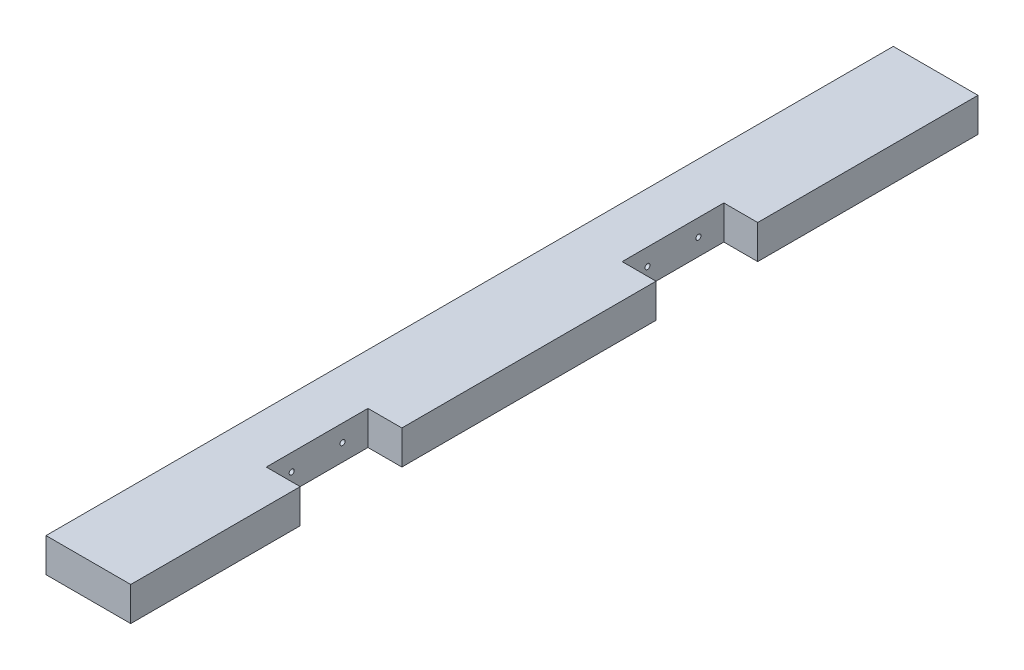
from build123d import *

# Parameters (mm, degrees)
SKIZZE1_W                       = 50
SKIZZE1_H                       = 20
AUFSATZ_LINEAR_AUSTRAGEN1_DEPTH = 500
SKIZZE2_W                       = 20
SKIZZE2_H                       = 60
SCHNITT_LINEAR_AUSTRAGEN1_DEPTH = 502.023951523
SKIZZE3_R                       = 1.5
SCHNITT_LINEAR_AUSTRAGEN2_DEPTH = 20


with BuildPart() as part:
    # Skizze1 → Aufsatz-Linear austragen1 (new body)
    with BuildSketch(Plane.XY):
        Rectangle(SKIZZE1_W, SKIZZE1_H)
    extrude(amount=AUFSATZ_LINEAR_AUSTRAGEN1_DEPTH)

    # Skizze2 → Schnitt-Linear austragen1 (cut, through all)
    with BuildSketch(Plane(origin=(0, 10, 0), x_dir=(1, 0, 0), z_dir=(0, 1, 0))):
        with Locations((15, -370)):
            Rectangle(SKIZZE2_W, SKIZZE2_H)
        with Locations((15, -160)):
            Rectangle(SKIZZE2_W, SKIZZE2_H)
    extrude(amount=-SCHNITT_LINEAR_AUSTRAGEN1_DEPTH, mode=Mode.SUBTRACT)

    # Skizze3 → Schnitt-Linear austragen2 (cut)
    with BuildSketch(Plane(origin=(5, 0, 0), x_dir=(0, 0, -1), z_dir=(1, 0, 0))):
        with Locations((-385, 0)):
            Circle(SKIZZE3_R)
        with Locations((-355, 0)):
            Circle(SKIZZE3_R)
        with Locations((-175, 0)):
            Circle(SKIZZE3_R)
        with Locations((-145, 0)):
            Circle(SKIZZE3_R)
    extrude(amount=-SCHNITT_LINEAR_AUSTRAGEN2_DEPTH, mode=Mode.SUBTRACT)


solid = part.part
